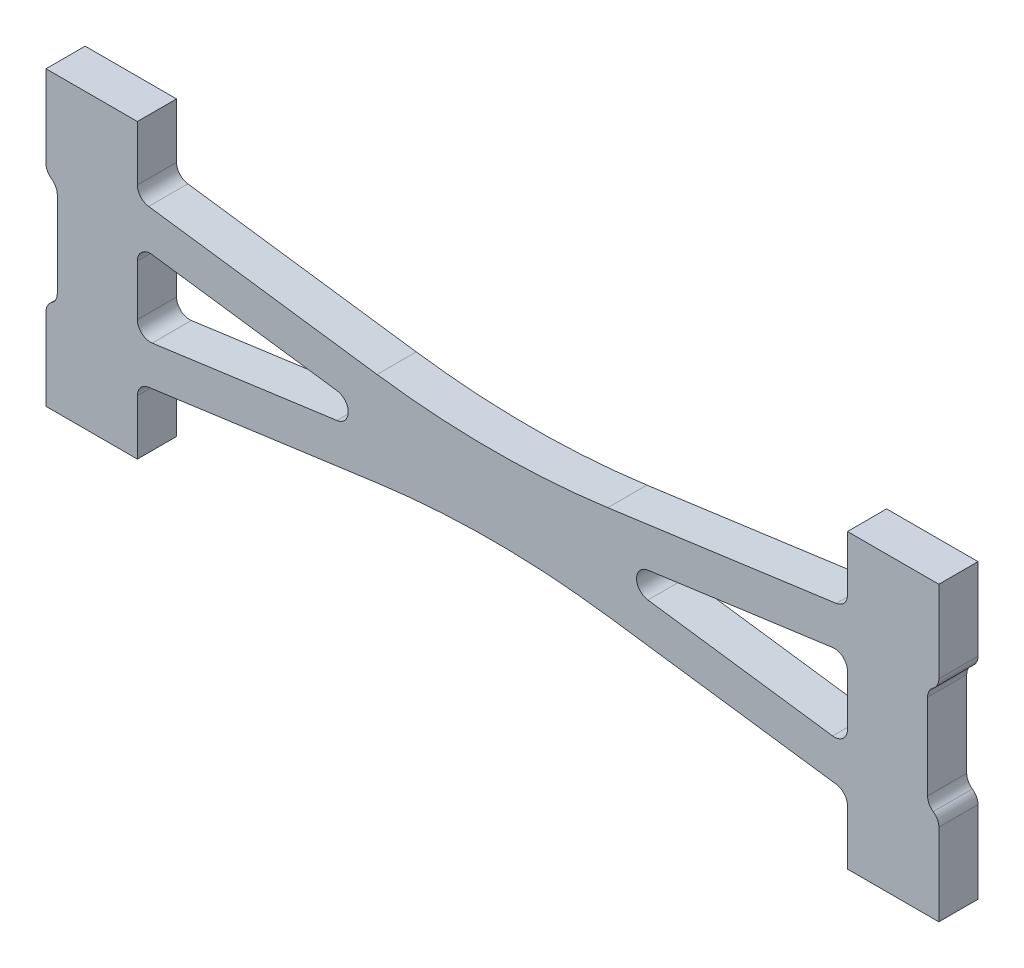
from build123d import *

# Parameters (mm, degrees)
BOSS_EXTRUDE1_DEPTH = 3.81


with BuildPart() as part:
    # Sketch1 → Boss-Extrude1 (new body)
    with BuildSketch(Plane.XY):
        with BuildLine():
            Line((-43.434, -9.779), (-43.434, -14.224))
            Line((-43.434, -14.224), (-34.544, -14.224))
            Line((-34.544, -14.224), (-34.544, -9.779))
            Line((-34.544, -9.779), (-34.544, -8.876475723))
            ThreePointArc((-34.544, -8.876475723), (-34.231125677, -8.041724001), (-33.446660728, -7.618267365))
            Line((-33.446660728, -7.618267365), (-11.222947321, -4.568563784))
            ThreePointArc((-11.222947321, -4.568563784), (0, -3.802107076), (11.222947321, -4.568563784))
            Line((11.222947321, -4.568563784), (33.446660728, -7.618267365))
            ThreePointArc((33.446660728, -7.618267365), (34.231125677, -8.041724001), (34.544, -8.876475723))
            Line((34.544, -8.876475723), (34.544, -9.779))
            Line((34.544, -9.779), (34.544, -14.224))
            Line((34.544, -14.224), (43.434, -14.224))
            Line((43.434, -14.224), (43.434, -9.779))
            Line((43.434, -9.779), (43.434, -6.250721328))
            ThreePointArc((43.434, -6.250721328), (43.288497568, -5.660462724), (42.885330364, -5.205454612))
            ThreePointArc((42.885330364, -5.205454612), (42.48216316, -4.7504465), (42.336660728, -4.160187897))
            Line((42.336660728, -4.160187897), (42.336660728, 4.160187897))
            ThreePointArc((42.336660728, 4.160187897), (42.48216316, 4.7504465), (42.885330364, 5.205454612))
            ThreePointArc((42.885330364, 5.205454612), (43.288497568, 5.660462724), (43.434, 6.250721328))
            Line((43.434, 6.250721328), (43.434, 9.779))
            Line((43.434, 9.779), (43.434, 14.224))
            Line((43.434, 14.224), (34.544, 14.224))
            Line((34.544, 14.224), (34.544, 9.779))
            Line((34.544, 9.779), (34.544, 8.876475723))
            ThreePointArc((34.544, 8.876475723), (34.231125677, 8.041724001), (33.446660728, 7.618267365))
            Line((33.446660728, 7.618267365), (11.222947321, 4.568563784))
            ThreePointArc((11.222947321, 4.568563784), (0, 3.802107076), (-11.222947321, 4.568563784))
            Line((-11.222947321, 4.568563784), (-33.446660728, 7.618267365))
            ThreePointArc((-33.446660728, 7.618267365), (-34.231125677, 8.041724001), (-34.544, 8.876475723))
            Line((-34.544, 8.876475723), (-34.544, 9.779))
            Line((-34.544, 9.779), (-34.544, 14.224))
            Line((-34.544, 14.224), (-43.434, 14.224))
            Line((-43.434, 14.224), (-43.434, 9.779))
            Line((-43.434, 9.779), (-43.434, 6.250721328))
            ThreePointArc((-43.434, 6.250721328), (-43.288497568, 5.660462724), (-42.885330364, 5.205454612))
            ThreePointArc((-42.885330364, 5.205454612), (-42.48216316, 4.7504465), (-42.336660728, 4.160187897))
            Line((-42.336660728, 4.160187897), (-42.336660728, -4.160187897))
            ThreePointArc((-42.336660728, -4.160187897), (-42.48216316, -4.7504465), (-42.885330364, -5.205454612))
            ThreePointArc((-42.885330364, -5.205454612), (-43.288497568, -5.660462724), (-43.434, -6.250721328))
            Line((-43.434, -6.250721328), (-43.434, -9.779))
        make_face()
        with BuildLine():
            Line((-33.101339272, -3.725173331), (-15.12414212, -1.258208358))
            ThreePointArc((-15.12414212, -1.258208358), (-14.026802848, 0), (-15.12414212, 1.258208358))
            Line((-15.12414212, 1.258208358), (-33.101339272, 3.725173331))
            ThreePointArc((-33.101339272, 3.725173331), (-34.108751722, 3.42409065), (-34.544, 2.466964972))
            Line((-34.544, 2.466964972), (-34.544, -2.466964972))
            ThreePointArc((-34.544, -2.466964972), (-34.108751722, -3.42409065), (-33.101339272, -3.725173331))
        make_face(mode=Mode.SUBTRACT)
        with BuildLine():
            Line((34.544, -2.466964972), (34.544, 2.466964972))
            ThreePointArc((34.544, 2.466964972), (34.108751722, 3.42409065), (33.101339272, 3.725173331))
            Line((33.101339272, 3.725173331), (15.12414212, 1.258208358))
            ThreePointArc((15.12414212, 1.258208358), (14.026802848, 0), (15.12414212, -1.258208358))
            Line((15.12414212, -1.258208358), (33.101339272, -3.725173331))
            ThreePointArc((33.101339272, -3.725173331), (34.108751722, -3.42409065), (34.544, -2.466964972))
        make_face(mode=Mode.SUBTRACT)
    extrude(amount=BOSS_EXTRUDE1_DEPTH)


solid = part.part
